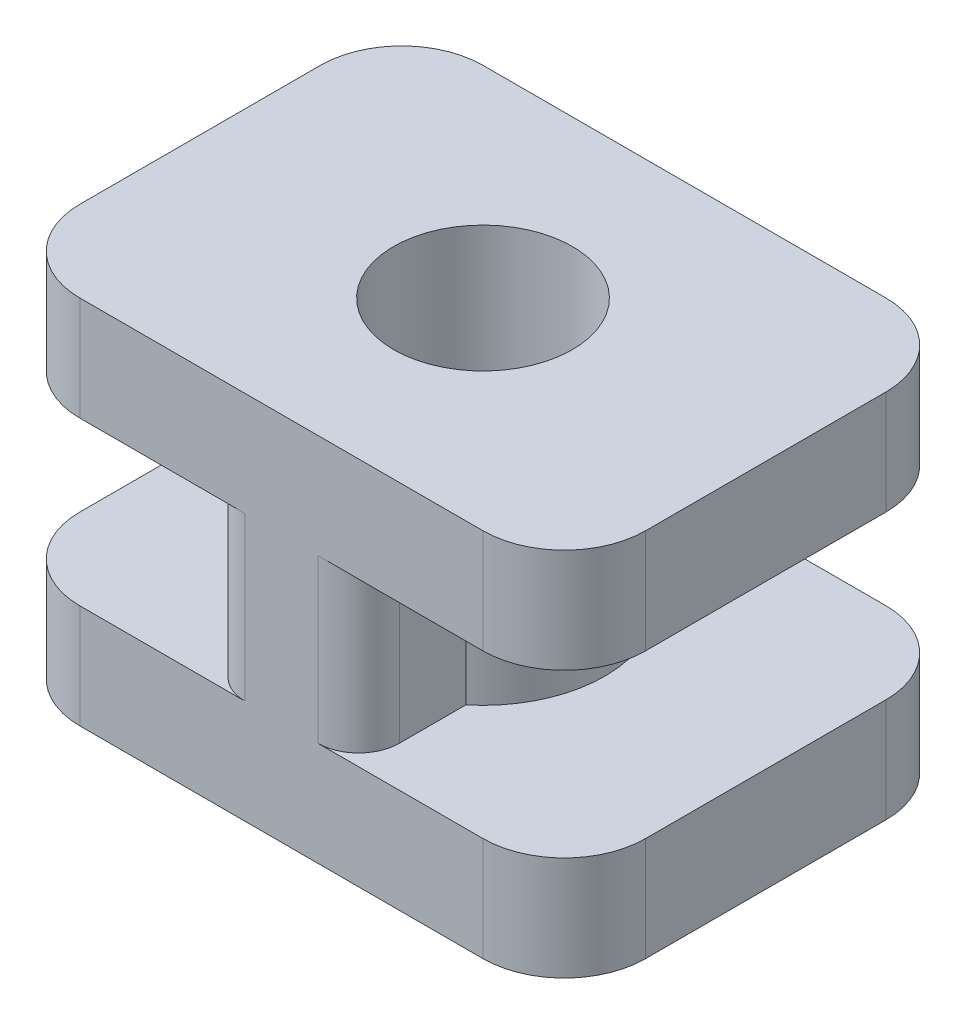
from build123d import *

# Parameters (mm, degrees)
SKETCH_1_W           = 8.8392
SKETCH_1_H           = 6.2992
EXTRUDE_1_DEPTH      = 1.6256
EXTRUDE_2_DEPTH      = 2.54
SKETCH_3_W           = 5.6261
SKETCH_3_H           = 6.2992
EXTRUDE_3_DEPTH      = 1.6256
SKETCH_4_W           = 6.2992
SKETCH_4_H           = 1.6256
EXTRUDE_4_DEPTH      = 3.2131
HOLE_WIZARD_M2_5_1_D = 2.794
FILLET_1_R           = 0.635
FILLET_2_R           = 1.27


with BuildPart() as part:
    # 草圖1 → 填料-伸長1 (new body)
    with BuildSketch(Plane.XZ.offset(-4.1656)):
        Rectangle(SKETCH_1_W, SKETCH_1_H)
    extrude(amount=-EXTRUDE_1_DEPTH)

    # 草圖2 → 填料-伸長2 (add)
    with BuildSketch(Plane.XZ.offset(-4.1656)):
        with BuildLine():
            Line((-1.2065, 1.474239719), (-1.2065, 3.1496))
            Line((-1.2065, 3.1496), (1.2065, 3.1496))
            Line((1.2065, 3.1496), (1.2065, 1.474239719))
            ThreePointArc((1.2065, 1.474239719), (0, -1.905), (-1.2065, 1.474239719))
        make_face()
    extrude(amount=EXTRUDE_2_DEPTH)

    # 草圖3 → 填料-伸長3 (add)
    with BuildSketch(Plane.XZ.offset(-1.6256)):
        with Locations((-1.60655, 0)):
            Rectangle(SKETCH_3_W, SKETCH_3_H)
    extrude(amount=EXTRUDE_3_DEPTH)

    # 草圖4 → 填料-伸長4 (add)
    with BuildSketch(Plane(origin=(1.2065, 0, 0), x_dir=(0, 0, -1), z_dir=(1, 0, 0))):
        with Locations((0, 0.8128)):
            Rectangle(SKETCH_4_W, SKETCH_4_H)
    extrude(amount=EXTRUDE_4_DEPTH)

    # M2.5 餘隙孔1 (through all)
    with Locations(Plane(origin=(0, 5.7912, 0), x_dir=(1, 0, 0), z_dir=(0, 1, 0))):
        with Locations((0, 0)):
            Hole(HOLE_WIZARD_M2_5_1_D / 2)

    # 圓角1
    fillet_1_edges = [part.edges().sort_by_distance(p)[0] for p in [
        (-1.2065, 2.8956, 3.1496),
        (1.2065, 2.8956, 3.1496),
    ]]
    fillet(fillet_1_edges, radius=FILLET_1_R)

    # 圓角2
    fillet_2_edges = [part.edges().sort_by_distance(p)[0] for p in [
        (-4.4196, 0.8128, 3.1496),
        (-4.4196, 0.8128, -3.1496),
        (4.4196, 0.8128, 3.1496),
        (4.4196, 0.8128, -3.1496),
        (4.4196, 4.9784, -3.1496),
        (-4.4196, 4.9784, -3.1496),
        (-4.4196, 4.9784, 3.1496),
        (4.4196, 4.9784, 3.1496),
    ]]
    fillet(fillet_2_edges, radius=FILLET_2_R)


solid = part.part
